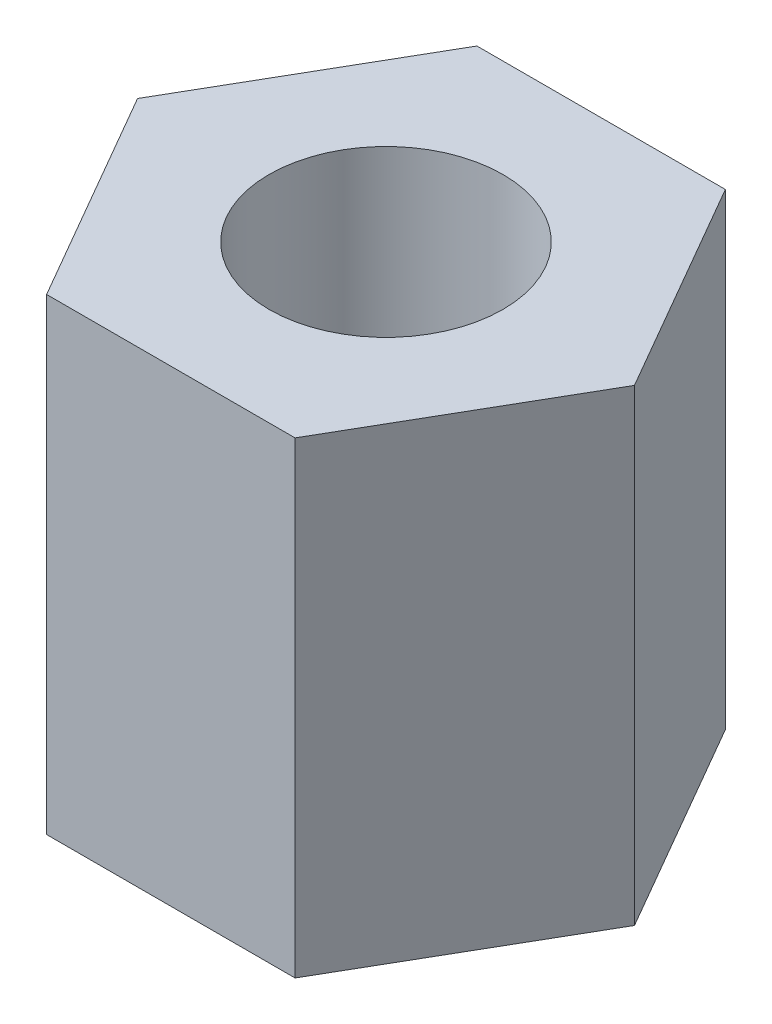
from build123d import *

# Parameters (mm, degrees)
EXTRUDE_1_DEPTH = 2.5
SKETCH_3_W      = 1.25
SKETCH_3_H      = 5.001


with BuildPart() as part:
    # 草图1 → 凸台-拉伸1 (new, symmetric)
    with BuildSketch(Plane(origin=(0, 0, 0), x_dir=(1, 0, 0), z_dir=(0, 1, 0))):
        Polygon((1.327905619, -2.3), (2.655811238, 0), (1.327905619, 2.3), (-1.327905619, 2.3), (-2.655811238, 0), (-1.327905619, -2.3), align=None)
    extrude(amount=EXTRUDE_1_DEPTH, both=True)

    # 草图3 → M3 螺纹孔1 (revolve, cut)
    with BuildSketch(Plane(origin=(0, 2.5, 0), x_dir=(0, 0, 1), z_dir=(1, 0, 0))):
        with Locations((0.625, 2.5005)):
            Rectangle(SKETCH_3_W, SKETCH_3_H)
    revolve(axis=Axis((0, 8.85, 0), (0, -1, 0)), mode=Mode.SUBTRACT)


solid = part.part
